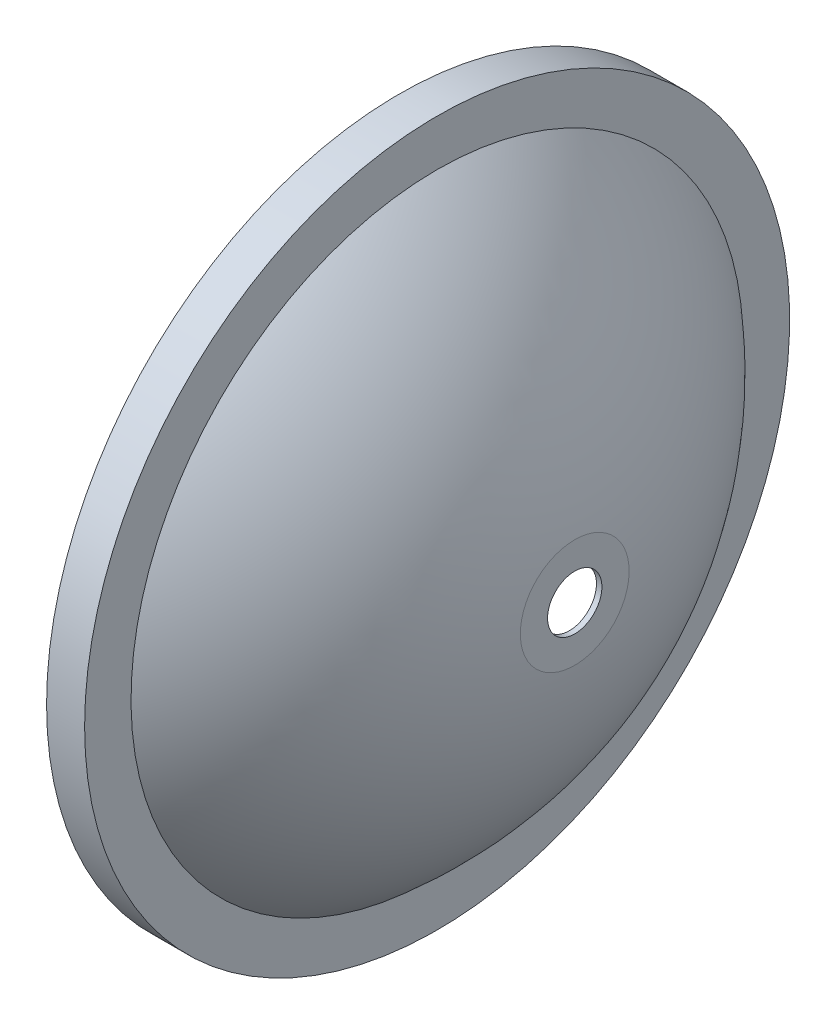
from build123d import *


with BuildPart() as part:
    # Szkic1 → Obrót1 (revolve)
    with BuildSketch(Plane.XY, mode=Mode.PRIVATE) as obr_t1_sk:
        with BuildLine():
            Line((-31.319935083, 63.856960175), (-25.319935083, 63.856960175))
            Line((-25.319935083, 63.856960175), (-25.319935083, 55.856960175))
            ThreePointArc((-25.319935083, 55.856960175), (-8.395162691, 35.250864878), (0, 9.941176471))
            Line((0, 9.941176471), (0, 5))
            Line((0, 5), (1, 5))
            Line((1, 5), (1, 10.0093516))
            ThreePointArc((1, 10.0093516), (-7.390646301, 35.49911912), (-24.319935083, 56.320511361))
            Line((-24.319935083, 56.320511361), (-24.319935083, 64.856960175))
            Line((-24.319935083, 64.856960175), (-31.319935083, 64.856960175))
            Line((-31.319935083, 64.856960175), (-31.319935083, 63.856960175))
        make_face()
    revolve(obr_t1_sk.sketch.rotate(Axis((-67.855420072, 0, 0), (1, 0, 0)), 90), axis=Axis((-67.855420072, 0, 0), (1, 0, 0)))


solid = part.part
